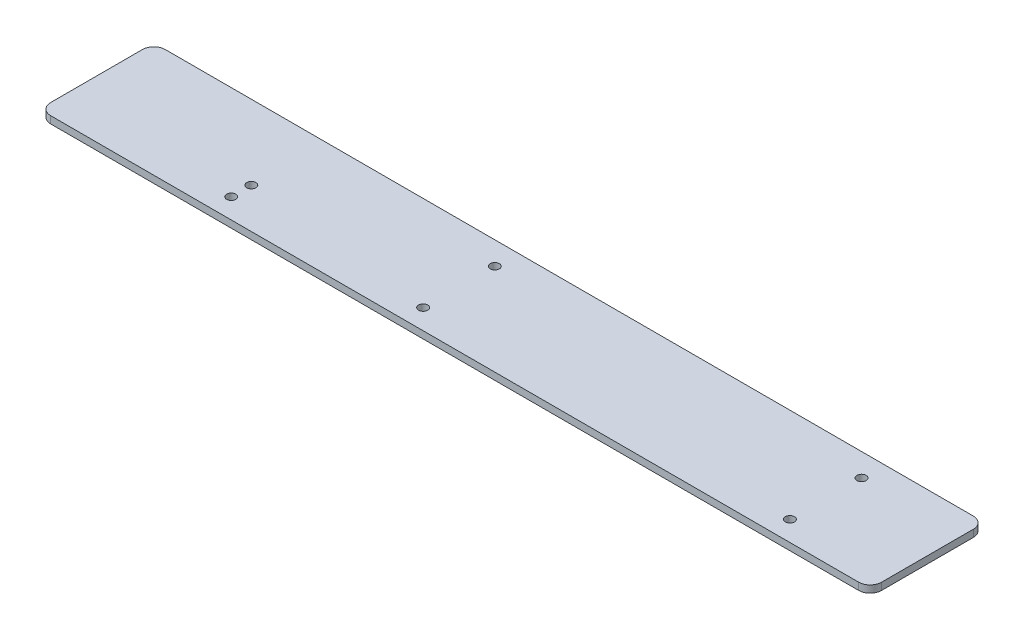
from build123d import *

# Parameters (mm, degrees)
SKETCH1_W           = 368.3
SKETCH1_H           = 50.8
SKETCH1_R           = 2.032
BOSS_EXTRUDE1_DEPTH = 3.175
FILLET1_R           = 5.08


with BuildPart() as part:
    # Sketch1 → Boss-Extrude1 (new body)
    with BuildSketch(Plane(origin=(0, 0, 0), x_dir=(1, 0, 0), z_dir=(0, 1, 0))):
        Rectangle(SKETCH1_W, SKETCH1_H)
        with Locations(Location((139.7, 15.24, 0), (0, 0, 270))):
            Circle(SKETCH1_R, mode=Mode.SUBTRACT)
        with Locations(Location((139.7, -16.51, 0), (0, 0, 270))):
            Circle(SKETCH1_R, mode=Mode.SUBTRACT)
        with Locations(Location((-22.86, 15.24, 0), (0, 0, 270))):
            Circle(SKETCH1_R, mode=Mode.SUBTRACT)
        with Locations(Location((-22.86, -16.51, 0), (0, 0, 270))):
            Circle(SKETCH1_R, mode=Mode.SUBTRACT)
        with Locations(Location((-107.95, -16.51, 0), (0, 0, 270))):
            Circle(SKETCH1_R, mode=Mode.SUBTRACT)
        with Locations(Location((-107.95, -7.62, 0), (0, 0, 270))):
            Circle(SKETCH1_R, mode=Mode.SUBTRACT)
    extrude(amount=BOSS_EXTRUDE1_DEPTH)

    # Fillet1
    fillet1_edges = [part.edges().sort_by_distance(p)[0] for p in [
        (184.15, 1.5875, 25.4),
        (-184.15, 1.5875, 25.4),
        (-184.15, 1.5875, -25.4),
        (184.15, 1.5875, -25.4),
    ]]
    fillet(fillet1_edges, radius=FILLET1_R)


solid = part.part
